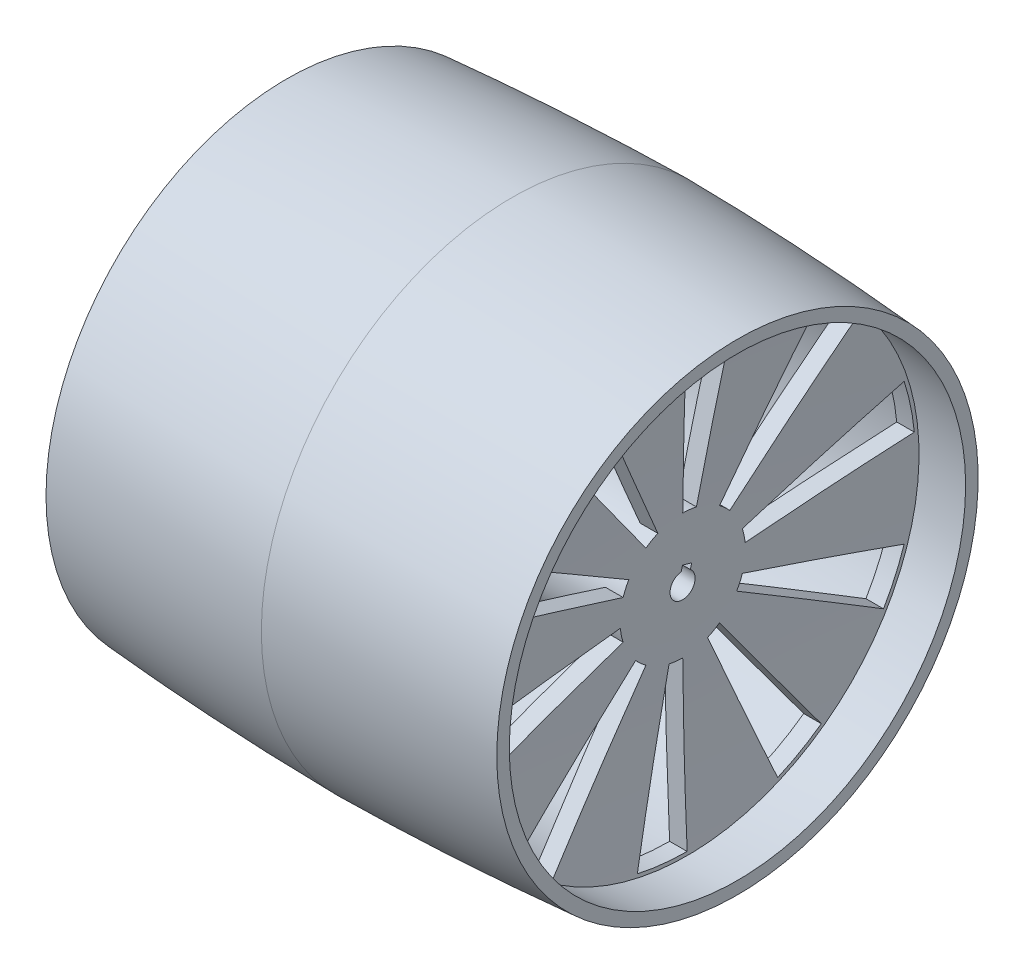
from build123d import *
from build123d.topology import SkipClean

# Parameters (mm, degrees)
CUT_EXTRUDE2_DEPTH = 291.505099819
CIRPATTERN2_COUNT  = 10
CUT_EXTRUDE3_DEPTH = 229.238230265


with BuildPart() as part:
    # Sketch1 → Revolve1 (revolve)
    with BuildSketch(Plane.XY, mode=Mode.PRIVATE) as revolve1_sk:
        with BuildLine():
            Line((114.165683246, 121.92), (114.165683246, 115.57))
            add(Edge.make_bspline(
                [(88.765683246, 117.363417198), (101.470434799, 116.561542769), (114.165683246, 115.57)],
                knots=[0.777225921, 0.777225921, 0.777225921, 1, 1, 1], degree=2))
            add(Edge.make_bspline(
                [(88.765683246, 117.363417198), (86.228389602, 61.893360561), (86.36, 6.35)],
                knots=[0, 0, 0, 1, 1, 1], degree=2))
            Line((86.36, 6.35), (26.67, 6.35))
            Line((26.67, 6.35), (26.67, 31.75))
            Line((26.67, 31.75), (77.47, 31.75))
            add(Edge.make_bspline(
                [(79.875683246, 117.901235045), (78.401642067, 78.845698625), (77.58674911, 64.729243269), (77.47, 31.75)],
                knots=[0, 0, 0, 0, 0.886493288, 0.886493288, 0.886493288, 0.886493288], degree=3))
            add(Edge.make_bspline(
                [(0, 120.65), (26.65644238, 120.356710873), (53.281668486, 119.440455983), (79.875683246, 117.901235045)],
                knots=[0, 0, 0, 0, 0.69929435, 0.69929435, 0.69929435, 0.69929435], degree=3))
            add(Edge.make_bspline(
                [(0, 120.65), (-57.178584531, 120.020889314), (-114.165683246, 115.57)],
                knots=[0, 0, 0, 1, 1, 1], degree=2))
            Line((-114.165683246, 115.57), (-114.165683246, 121.92))
            add(Edge.make_bspline(
                [(0, 127), (-57.178584531, 126.370889314), (-114.165683246, 121.92)],
                knots=[0, 0, 0, 1, 1, 1], degree=2))
            add(Edge.make_bspline(
                [(0, 127), (57.178584531, 126.370889314), (114.165683246, 121.92)],
                knots=[0, 0, 0, 1, 1, 1], degree=2))
        make_face()
    revolve(revolve1_sk.sketch.rotate(Axis((0, 0, 0), (1, 0, 0)), 90), axis=Axis((0, 0, 0), (1, 0, 0)))

    # Sketch4 → Cut-Extrude2 (cut, through all)
    with SkipClean():  # the faces are left unmerged after this step: merging them gives an invalid solid
        with BuildSketch(Plane.ZY.offset(114.165683246)):
            with BuildLine():
                Line((0, 31.75), (0, 115.57))
                ThreePointArc((0, 115.57), (-12.7, 114.870078349), (-25.246171066, 112.778791209))
                Line((-25.246171066, 112.778791209), (-6.935761282, 30.983184398))
                ThreePointArc((-6.935761282, 30.983184398), (-3.489010989, 31.557713832), (0, 31.75))
            make_face()
        cut_extrude2 = extrude(amount=-CUT_EXTRUDE2_DEPTH, mode=Mode.SUBTRACT)

    # CirPattern2: Cut-Extrude2 ×10 about axis
    cirpattern2_axis = Axis((0, 0, 0), (1, 0, 0))
    for i in range(1, CIRPATTERN2_COUNT):
        add(cut_extrude2.rotate(cirpattern2_axis, i * 360 / CIRPATTERN2_COUNT), mode=Mode.SUBTRACT)

    # Sketch5 → Cut-Extrude3 (cut, through all)
    with BuildSketch(Plane.ZY.offset(-26.67)):
        with BuildLine():
            Line((0, 8.89), (-4.646909592, 7.578808036))
            Line((-4.646909592, 7.578808036), (-3.918381117, 4.996877968))
            ThreePointArc((-3.918381117, 4.996877968), (-1.724411801, 6.111374963), (0.728528475, 6.308069932))
            Line((0.728528475, 6.308069932), (0, 8.89))
        make_face()
    extrude(amount=-CUT_EXTRUDE3_DEPTH, mode=Mode.SUBTRACT)


solid = part.part
